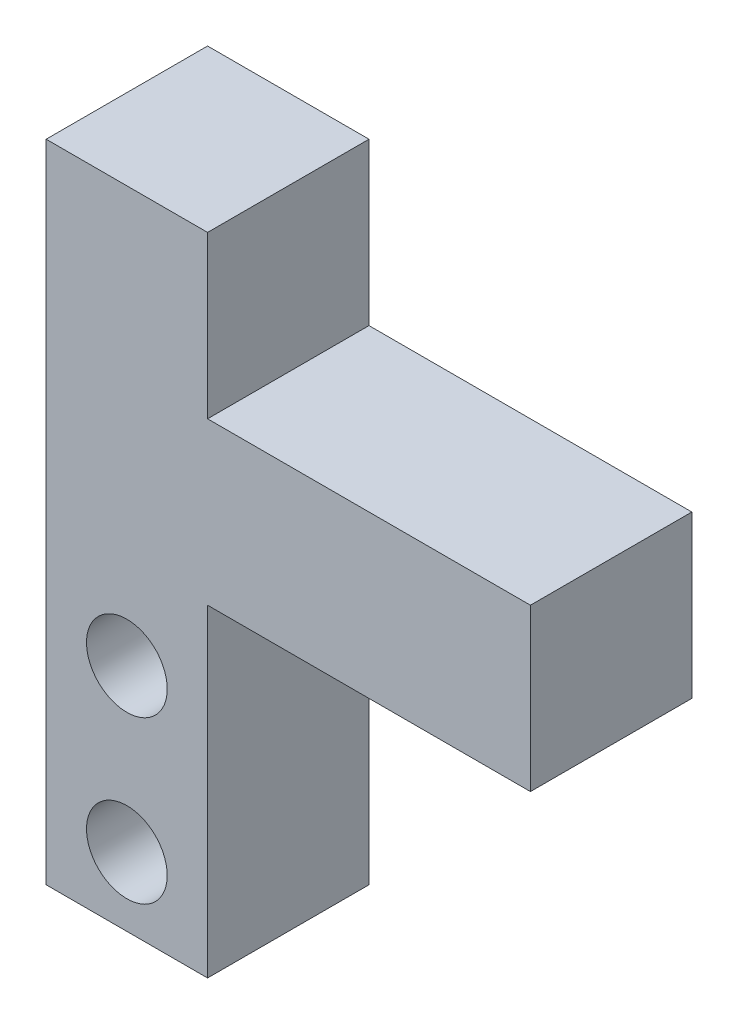
from build123d import *

# Parameters (mm, degrees)
ESQUISSE1_R        = 2.5
BOSS_EXTRU_1_DEPTH = 10


with BuildPart() as part:
    # Esquisse1 → Boss.-Extru.1 (new body)
    with BuildSketch(Plane.XY):
        Polygon((5, 10), (5, 20), (-5, 20), (-5, -20), (5, -20), (5, 0), (25, 0), (25, 10), align=None)
        with Locations((0, -5.749164875)):
            Circle(ESQUISSE1_R, mode=Mode.SUBTRACT)
        with Locations((0, -15.749164875)):
            Circle(ESQUISSE1_R, mode=Mode.SUBTRACT)
    extrude(amount=BOSS_EXTRU_1_DEPTH)


solid = part.part
